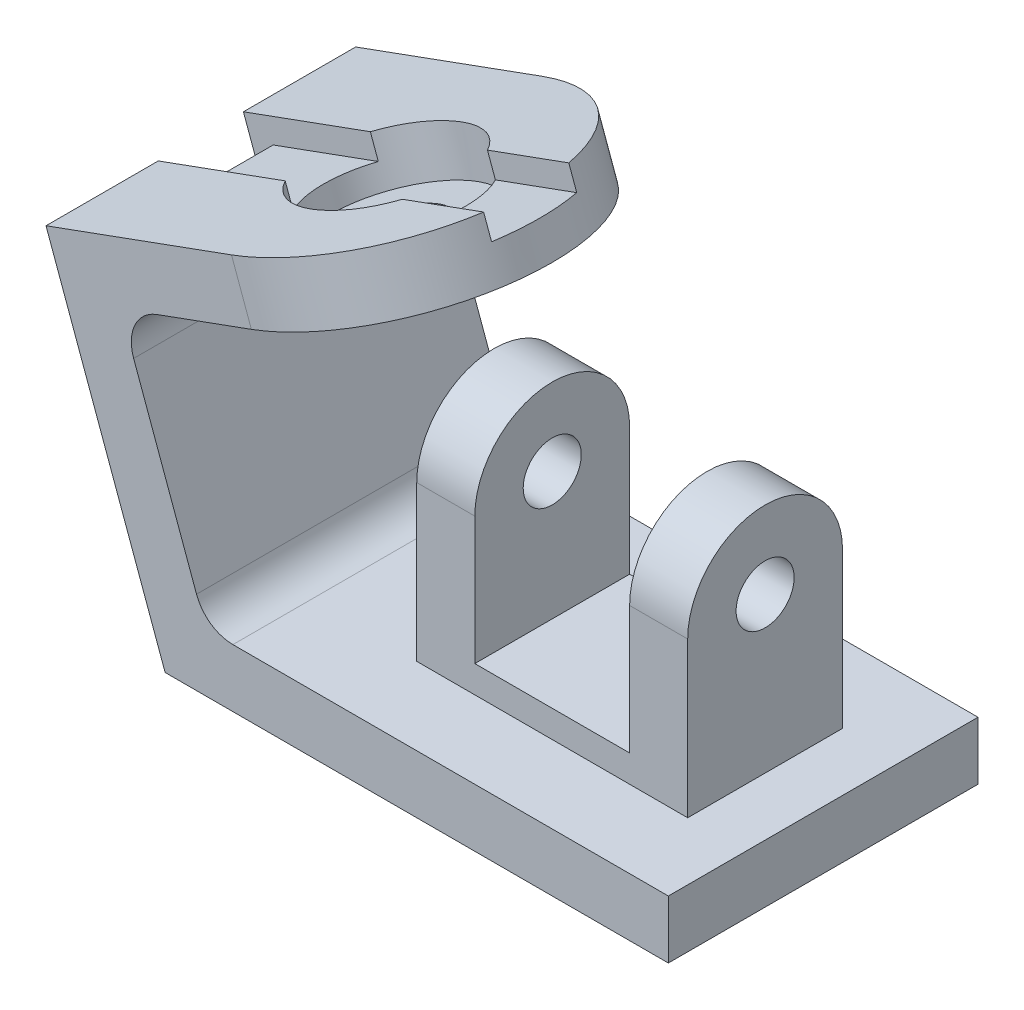
from build123d import *

# Parameters (mm, degrees)
BOSS_EXTRU_1_DEPTH      = 80
BOSS_EXTRU_2_DEPTH      = 15
ENL_V_MAT_EXTRU_1_REACH = 200.503
ESQUISSE3_R             = 9.5
ENL_V_MAT_EXTRU_2_DEPTH = 6
ESQUISSE5_R             = 19.5
ENL_V_MAT_EXTRU_3_DEPTH = 12
ESQUISSE6_W             = 22
ESQUISSE6_H             = 56
ENL_V_MAT_EXTRU_4_DEPTH = 6
BOSS_EXTRU_3_DEPTH      = 70
ESQUISSE9_W             = 40
ESQUISSE9_H             = 53
ENL_V_MAT_EXTRU_5_DEPTH = 184.749362655
ESQUISSE10_R            = 7.5
ENL_V_MAT_EXTRU_6_DEPTH = 164.97813353
CONG_1_R                = 10


with BuildPart() as part:
    # Esquisse1 → Boss.-Extru.1 (new body)
    with BuildSketch(Plane.XY):
        Polygon((0, 0), (-30.781812899, 84.572335871), (17.142510761, 102.01536318), (22.272812911, 87.919973869), (-11.556121438, 75.607248709), (10.503113073, 15), (130, 15), (130, 0), align=None)
    extrude(amount=-BOSS_EXTRU_1_DEPTH)

    # Esquisse2 → Boss.-Extru.2 (add)
    with BuildSketch(Plane(origin=(-30.781812899, 84.572335871, 0), x_dir=(0.9396926207859094, 0.3420201433256664, 0), z_dir=(-0.3420201433256664, 0.9396926207859094, 0))):
        with BuildLine():
            Line((51, 80), (51, 0))
            ThreePointArc((51, 0), (91, 40), (51, 80))
        make_face()
    extrude(amount=-BOSS_EXTRU_2_DEPTH)

    # Esquisse3 → Enlèv. mat.-Extru.1 (cut, up to next)
    with BuildSketch(Plane(origin=(-30.781812899, 84.572335871, 0), x_dir=(0.9396926207859094, 0.3420201433256664, 0), z_dir=(-0.3420201433256664, 0.9396926207859094, 0)), mode=Mode.PRIVATE) as enl_v_mat_extru_1_sk1:
        with Locations(Location((51, 40, 0), (0, 0, 180))):
            Circle(ESQUISSE3_R)
    enl_v_mat_extru_1_tool1 = extrude(enl_v_mat_extru_1_sk1.sketch, amount=-ENL_V_MAT_EXTRU_1_REACH, mode=Mode.PRIVATE) & part.part
    add(enl_v_mat_extru_1_tool1.solids().sort_by_distance((17.142511, 102.015363, -40))[0], mode=Mode.SUBTRACT)

    # Esquisse4 → Enlèv. mat.-Extru.2 (cut)
    with BuildSketch(Plane(origin=(-30.781812899, 84.572335871, 0), x_dir=(0.9396926207859094, 0.3420201433256664, 0), z_dir=(-0.3420201433256664, 0.9396926207859094, 0))):
        with BuildLine():
            Line((0, 51), (89.457769046, 51))
            ThreePointArc((89.457769046, 51), (91, 40), (89.457769046, 29))
            Line((89.457769046, 29), (0, 29))
            Line((0, 29), (0, 51))
        make_face()
    extrude(amount=-ENL_V_MAT_EXTRU_2_DEPTH, mode=Mode.SUBTRACT)

    # Esquisse5 → Enlèv. mat.-Extru.3 (cut)
    with BuildSketch(Plane(origin=(-30.781812899, 84.572335871, 0), x_dir=(0.9396926207859094, 0.3420201433256664, 0), z_dir=(-0.3420201433256664, 0.9396926207859094, 0))):
        with Locations(Location((51, 40, 0), (0, 0, 180))):
            Circle(ESQUISSE5_R)
    extrude(amount=-ENL_V_MAT_EXTRU_3_DEPTH, mode=Mode.SUBTRACT)

    # Esquisse6 → Enlèv. mat.-Extru.4 (cut)
    with BuildSketch(Plane(origin=(0, 0, 0), x_dir=(0, 0, 1), z_dir=(-0.9396926207859094, -0.34202014332566627, 0))):
        with Locations((-40, 62)):
            Rectangle(ESQUISSE6_W, ESQUISSE6_H)
    extrude(amount=-ENL_V_MAT_EXTRU_4_DEPTH, mode=Mode.SUBTRACT)

    # Esquisse8 → Boss.-Extru.3 (add)
    with BuildSketch(Plane(origin=(115, 0, 0), x_dir=(0, 0, -1), z_dir=(1, 0, 0))):
        with BuildLine():
            Line((20, 15), (20, 55))
            ThreePointArc((20, 55), (40, 75), (60, 55))
            Line((60, 55), (60, 15))
            Line((60, 15), (20, 15))
        make_face()
    extrude(amount=-BOSS_EXTRU_3_DEPTH)

    # Esquisse9 → Enlèv. mat.-Extru.5 (cut, through all)
    with BuildSketch(Plane.XY.offset(-20)):
        with Locations((80, 48.5)):
            Rectangle(ESQUISSE9_W, ESQUISSE9_H)
    extrude(amount=-ENL_V_MAT_EXTRU_5_DEPTH, mode=Mode.SUBTRACT)

    # Esquisse10 → Enlèv. mat.-Extru.6 (cut, through all)
    with BuildSketch(Plane.ZY.offset(-45)):
        with Locations((-40, 55)):
            Circle(ESQUISSE10_R)
    extrude(amount=-ENL_V_MAT_EXTRU_6_DEPTH, mode=Mode.SUBTRACT)

    # Congé1
    cong_1_edges = [part.edges().sort_by_distance(p)[0] for p in [
        (-11.556121438, 75.607248709, -40),
        (10.503113073, 15, -40),
    ]]
    fillet(cong_1_edges, radius=CONG_1_R)


solid = part.part
